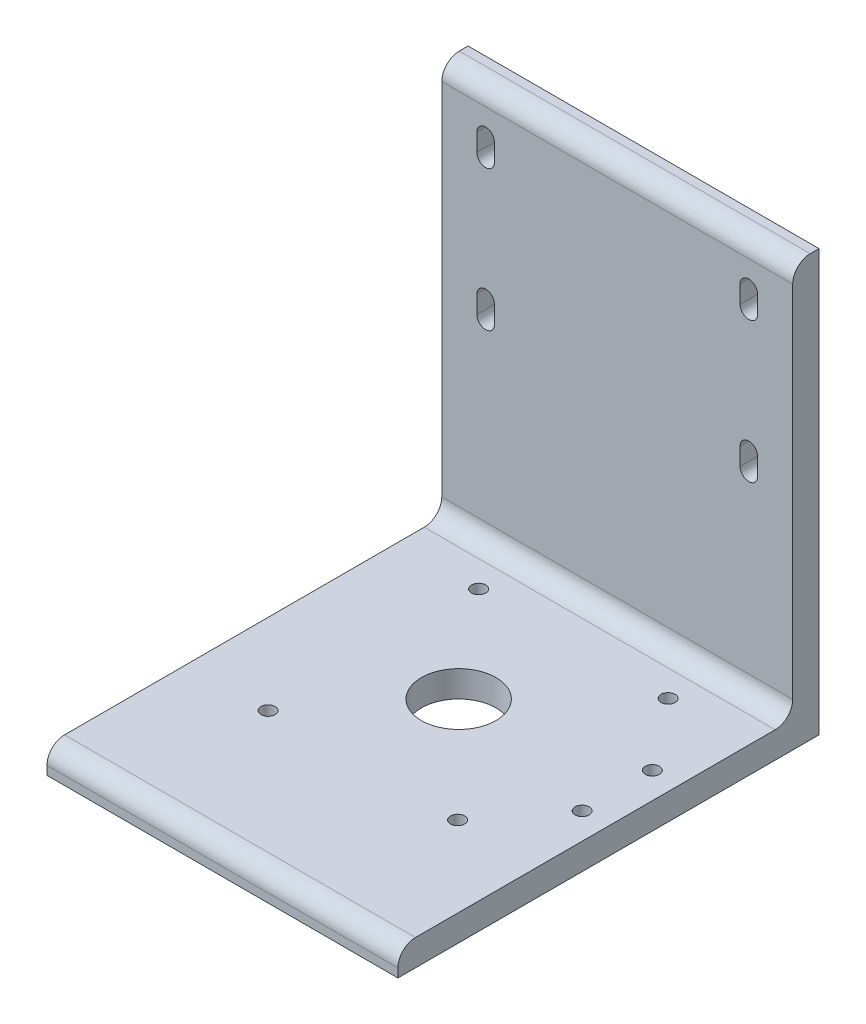
from build123d import *

# Parameters (mm, degrees)
F_6_X_6_ANGLE_BAR_EXTRUSION_DEPTH = 63.5
EXTRUSION_FILLETS_R               = 6.35
F_10_CLEARANCE_HOLE_ROUTER_D      = 5.1054
SKETCH7_R                         = 13.49375
F_1_OD_BIT_ACCESS_HOLE_DEPTH      = 219.337526836
TAPPED_HOLE_FOR_10_32_HELICOIL1_D = 5.1054
MOUNTING_SLOTS_REACH              = 226.686


with BuildPart() as part:
    # Sketch1 → 6" x 6" angle bar extrusion (new, symmetric)
    with BuildSketch(Plane(origin=(0, 0, 0), x_dir=(0, 0, -1), z_dir=(1, 0, 0))):
        Polygon((0, 0), (0, 152.4), (-9.525, 152.4), (-9.525, 9.525), (-152.4, 9.525), (-152.4, 0), align=None)
    extrude(amount=F_6_X_6_ANGLE_BAR_EXTRUSION_DEPTH, both=True)

    # extrusion fillets
    extrusion_fillets_edges = [part.edges().sort_by_distance(p)[0] for p in [
        (0, 9.525, 152.4),
        (0, 9.525, 9.525),
        (0, 152.4, 9.525),
    ]]
    fillet(extrusion_fillets_edges, radius=EXTRUSION_FILLETS_R)

    # #10 Clearance Hole - router (through all)
    with Locations(Plane(origin=(0, 9.525, 0), x_dir=(1, 0, 0), z_dir=(0, 1, 0))):
        with Locations((-34.29, -25.4), (34.29, -101.6), (-34.29, -101.6), (34.29, -25.4)):
            Hole(F_10_CLEARANCE_HOLE_ROUTER_D / 2)

    # Sketch7 → 1" OD bit access hole (cut, through all)
    with BuildSketch(Plane(origin=(0, 9.525, 0), x_dir=(1, 0, 0), z_dir=(0, 1, 0))):
        with Locations(Location((-3.4036, -63.5, 0), (0, 0, 270))):
            Circle(SKETCH7_R)
    extrude(amount=-F_1_OD_BIT_ACCESS_HOLE_DEPTH, mode=Mode.SUBTRACT)

    # Tapped Hole for #10-32 Helicoil1 (through all)
    with Locations(Plane(origin=(0, 0, 0), x_dir=(-1, 0, 0), z_dir=(0, -1, 0))):
        with Locations((-53.975, -50.8), (-53.975, -76.2)):
            Hole(TAPPED_HOLE_FOR_10_32_HELICOIL1_D / 2)

    # Sketch14 → mounting slots (cut, up to next)
    with BuildSketch(Plane(origin=(0, 0, 0), x_dir=(-1, 0, 0), z_dir=(0, 0, -1)), mode=Mode.PRIVATE) as mounting_slots_sk1:
        with BuildLine():
            Line((-44.45, 136.525), (-44.45, 130.175))
            ThreePointArc((-44.45, 130.175), (-47.625, 127), (-50.8, 130.175))
            Line((-50.8, 130.175), (-50.8, 136.525))
            ThreePointArc((-50.8, 136.525), (-47.625, 139.7), (-44.45, 136.525))
        make_face()
    mounting_slots_tool1 = extrude(mounting_slots_sk1.sketch, amount=-MOUNTING_SLOTS_REACH, mode=Mode.PRIVATE) & part.part
    # Sketch14 → mounting slots (cut, up to next)
    with BuildSketch(Plane(origin=(0, 0, 0), x_dir=(-1, 0, 0), z_dir=(0, 0, -1)), mode=Mode.PRIVATE) as mounting_slots_sk2:
        with BuildLine():
            Line((-44.45, 85.725), (-44.45, 79.375))
            ThreePointArc((-44.45, 79.375), (-47.625, 76.2), (-50.8, 79.375))
            Line((-50.8, 79.375), (-50.8, 85.725))
            ThreePointArc((-50.8, 85.725), (-47.625, 88.9), (-44.45, 85.725))
        make_face()
    mounting_slots_tool2 = extrude(mounting_slots_sk2.sketch, amount=-MOUNTING_SLOTS_REACH, mode=Mode.PRIVATE) & part.part
    # Sketch14 → mounting slots (cut, up to next)
    with BuildSketch(Plane(origin=(0, 0, 0), x_dir=(-1, 0, 0), z_dir=(0, 0, -1)), mode=Mode.PRIVATE) as mounting_slots_sk3:
        with BuildLine():
            Line((50.8, 85.725), (50.8, 79.375))
            ThreePointArc((50.8, 79.375), (47.625, 76.2), (44.45, 79.375))
            Line((44.45, 79.375), (44.45, 85.725))
            ThreePointArc((44.45, 85.725), (47.625, 88.9), (50.8, 85.725))
        make_face()
    mounting_slots_tool3 = extrude(mounting_slots_sk3.sketch, amount=-MOUNTING_SLOTS_REACH, mode=Mode.PRIVATE) & part.part
    # Sketch14 → mounting slots (cut, up to next)
    with BuildSketch(Plane(origin=(0, 0, 0), x_dir=(-1, 0, 0), z_dir=(0, 0, -1)), mode=Mode.PRIVATE) as mounting_slots_sk4:
        with BuildLine():
            Line((50.8, 136.525), (50.8, 130.175))
            ThreePointArc((50.8, 130.175), (47.625, 127), (44.45, 130.175))
            Line((44.45, 130.175), (44.45, 136.525))
            ThreePointArc((44.45, 136.525), (47.625, 139.7), (50.8, 136.525))
        make_face()
    mounting_slots_tool4 = extrude(mounting_slots_sk4.sketch, amount=-MOUNTING_SLOTS_REACH, mode=Mode.PRIVATE) & part.part
    add(mounting_slots_tool1.solids().sort_by_distance((47.625, 133.35, 0))[0], mode=Mode.SUBTRACT)
    add(mounting_slots_tool2.solids().sort_by_distance((47.625, 82.55, 0))[0], mode=Mode.SUBTRACT)
    add(mounting_slots_tool3.solids().sort_by_distance((-47.625, 82.55, 0))[0], mode=Mode.SUBTRACT)
    add(mounting_slots_tool4.solids().sort_by_distance((-47.625, 133.35, 0))[0], mode=Mode.SUBTRACT)


solid = part.part
